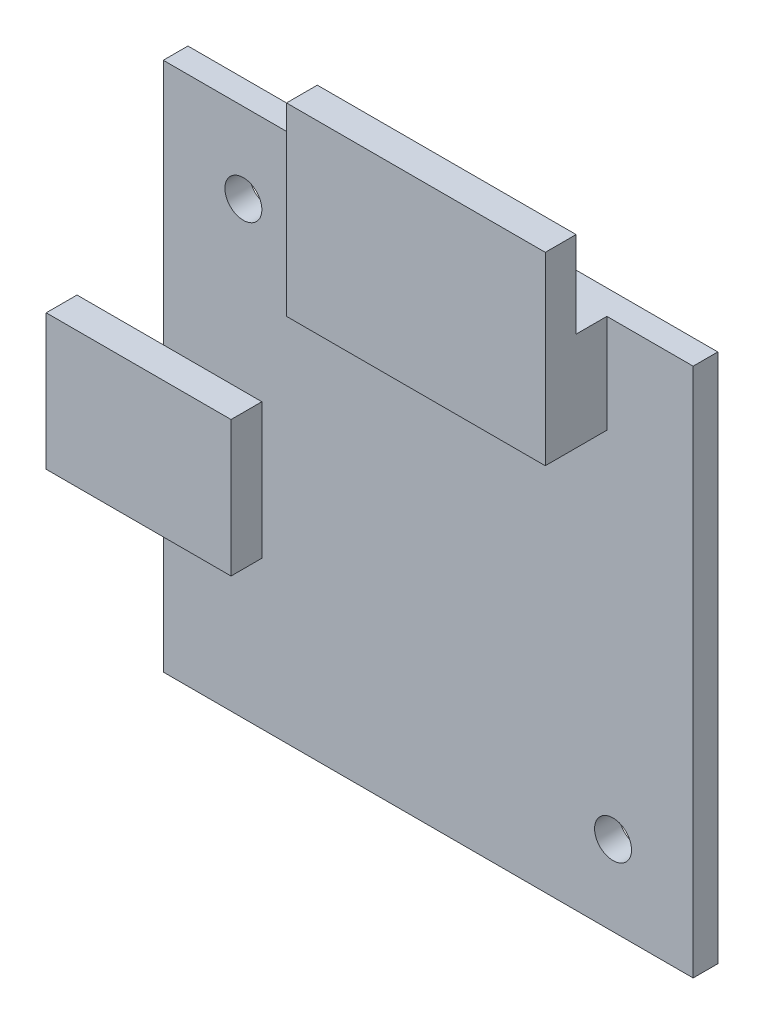
from build123d import *

# Parameters (mm, degrees)
SKETCH2_W           = 43
SKETCH2_H           = 43
BOSS_EXTRUDE1_DEPTH = 2
CUT_EXTRUDE1_REACH  = 62.844
SKETCH3_R           = 1.5
CUT_EXTRUDE2_REACH  = 62.844
SKETCH4_R           = 1.5
SKETCH5_W           = 21
SKETCH5_H           = 15
BOSS_EXTRUDE2_DEPTH = 5
SKETCH6_W           = 15
SKETCH6_H           = 11
BOSS_EXTRUDE3_DEPTH = 2.5
SKETCH7_W           = 21
SKETCH7_H           = 7
CUT_EXTRUDE3_DEPTH  = 2.5


with BuildPart() as part:
    # Sketch2 → Boss-Extrude1 (new body)
    with BuildSketch(Plane.XY):
        with Locations((21.5, 21.5)):
            Rectangle(SKETCH2_W, SKETCH2_H)
    extrude(amount=BOSS_EXTRUDE1_DEPTH)

    # Sketch3 → Cut-Extrude1 (cut, up to next)
    with BuildSketch(Plane.XY.offset(2), mode=Mode.PRIVATE) as cut_extrude1_sk1:
        with Locations((6.5, 36.5)):
            Circle(SKETCH3_R)
    cut_extrude1_tool1 = extrude(cut_extrude1_sk1.sketch, amount=-CUT_EXTRUDE1_REACH, mode=Mode.PRIVATE) & part.part
    add(cut_extrude1_tool1.solids().sort_by_distance((6.5, 36.5, 2))[0], mode=Mode.SUBTRACT)

    # Sketch4 → Cut-Extrude2 (cut, up to next)
    with BuildSketch(Plane.XY.offset(2), mode=Mode.PRIVATE) as cut_extrude2_sk1:
        with Locations((36.5, 6.5)):
            Circle(SKETCH4_R)
    cut_extrude2_tool1 = extrude(cut_extrude2_sk1.sketch, amount=-CUT_EXTRUDE2_REACH, mode=Mode.PRIVATE) & part.part
    add(cut_extrude2_tool1.solids().sort_by_distance((36.5, 6.5, 2))[0], mode=Mode.SUBTRACT)

    # Sketch5 → Boss-Extrude2 (add)
    with BuildSketch(Plane.XY.offset(2)):
        with Locations((25.5, 42.5)):
            Rectangle(SKETCH5_W, SKETCH5_H)
    extrude(amount=BOSS_EXTRUDE2_DEPTH)

    # Sketch6 → Boss-Extrude3 (add)
    with BuildSketch(Plane.XY.offset(2)):
        with Locations((0.5, 17.5)):
            Rectangle(SKETCH6_W, SKETCH6_H)
    extrude(amount=BOSS_EXTRUDE3_DEPTH)

    # Sketch7 → Cut-Extrude3 (cut)
    with BuildSketch(Plane(origin=(0, 0, 2), x_dir=(-1, 0, 0), z_dir=(0, 0, -1))):
        with Locations((-25.5, 46.5)):
            Rectangle(SKETCH7_W, SKETCH7_H)
    extrude(amount=-CUT_EXTRUDE3_DEPTH, mode=Mode.SUBTRACT)


solid = part.part
